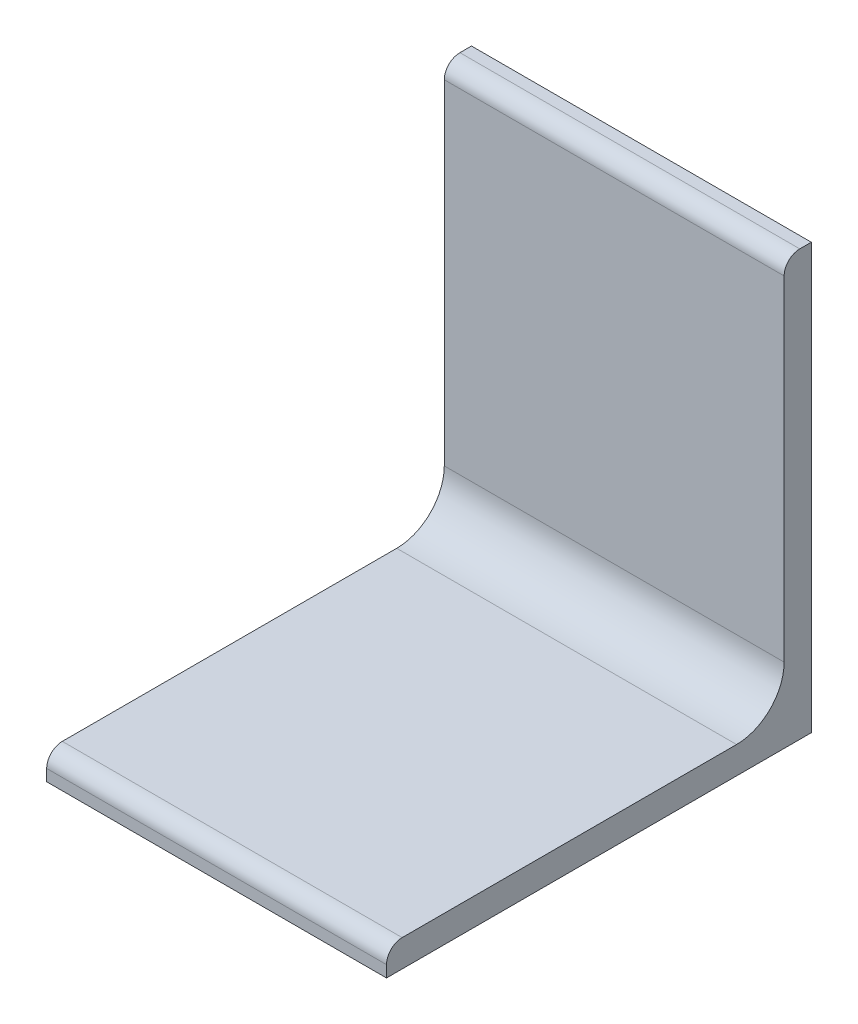
from build123d import *

# Parameters (mm, degrees)
MEMBER_8509_86_125_125_8_1_DEPTH = 100


with BuildPart() as part:
    # Sketch11 → Member 8509-86 125_125_8_1 (new body)
    with BuildSketch(Plane.YZ):
        with BuildLine():
            Line((-33.6, -33.6), (-33.6, 91.4))
            Line((-33.6, 91.4), (-30.2, 91.4))
            ThreePointArc((-30.2, 91.4), (-26.947308807, 90.052691193), (-25.6, 86.8))
            Line((-25.6, 86.8), (-25.6, -11.6))
            ThreePointArc((-25.6, -11.6), (-21.499494937, -21.499494937), (-11.6, -25.6))
            Line((-11.6, -25.6), (86.8, -25.6))
            ThreePointArc((86.8, -25.6), (90.052691193, -26.947308807), (91.4, -30.2))
            Line((91.4, -30.2), (91.4, -33.6))
            Line((91.4, -33.6), (-33.6, -33.6))
        make_face()
    extrude(amount=MEMBER_8509_86_125_125_8_1_DEPTH)


solid = part.part
